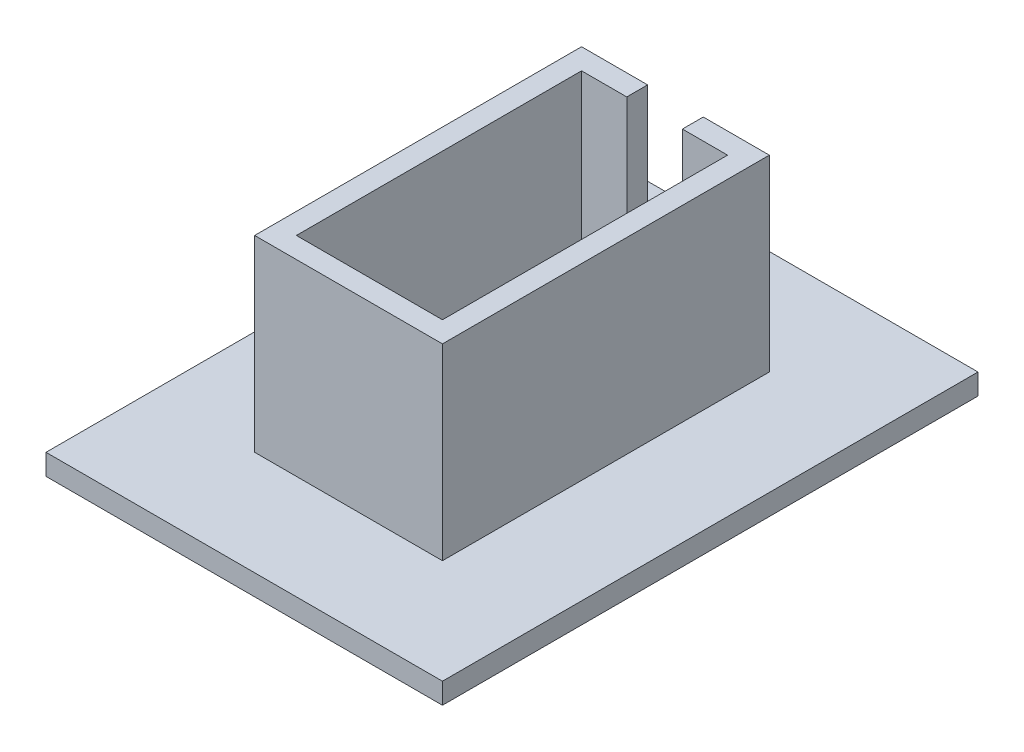
from build123d import *

# Parameters (mm, degrees)
SKETCH2_W           = 57
SKETCH2_H           = 77
BOSS_EXTRUDE1_DEPTH = 3
SKETCH3_W           = 27
SKETCH3_H           = 47
SKETCH3_W_2         = 21
SKETCH3_H_2         = 41
BOSS_EXTRUDE2_DEPTH = 27
SKETCH5_W           = 8
SKETCH5_H           = 3
CUT_EXTRUDE1_DEPTH  = 27


with BuildPart() as part:
    # Sketch2 → Boss-Extrude1 (new body)
    with BuildSketch(Plane(origin=(0, 0, 0), x_dir=(1, 0, 0), z_dir=(0, 1, 0))):
        with Locations((-34.881738231, 37.167822038)):
            Rectangle(SKETCH2_W, SKETCH2_H)
    extrude(amount=BOSS_EXTRUDE1_DEPTH)

    # Sketch3 → Boss-Extrude2 (add)
    with BuildSketch(Plane(origin=(0, 3, 0), x_dir=(1, 0, 0), z_dir=(0, 1, 0))):
        with Locations((-34.881738231, 37.167822038)):
            Rectangle(SKETCH3_W, SKETCH3_H)
        with Locations((-34.881738231, 37.167822038)):
            Rectangle(SKETCH3_W_2, SKETCH3_H_2, mode=Mode.SUBTRACT)
    extrude(amount=BOSS_EXTRUDE2_DEPTH)

    # Sketch5 → Cut-Extrude1 (cut)
    with BuildSketch(Plane(origin=(0, 30, 0), x_dir=(1, 0, 0), z_dir=(0, 1, 0))):
        with Locations((-34.881738231, 59.167822038)):
            Rectangle(SKETCH5_W, SKETCH5_H)
    extrude(amount=-CUT_EXTRUDE1_DEPTH, mode=Mode.SUBTRACT)


solid = part.part
